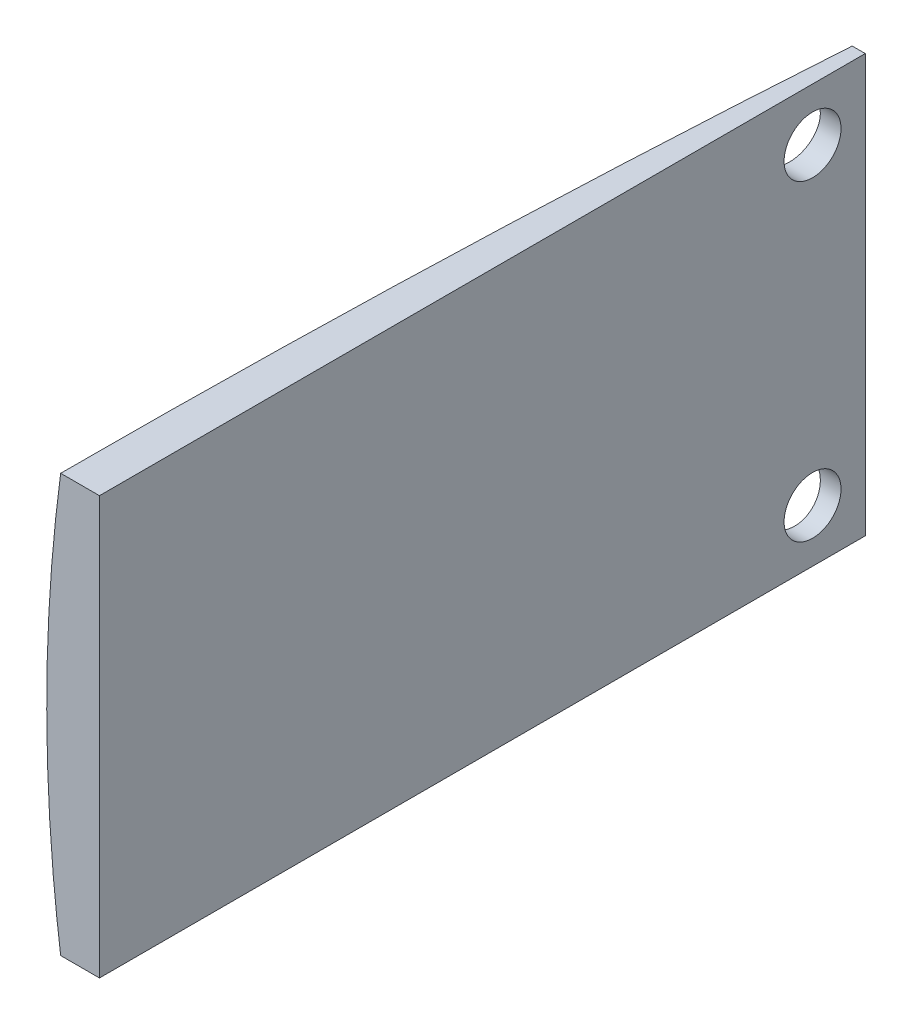
from build123d import *

# Parameters (mm, degrees)
CUT_EXTRUDE2_DEPTH      = 3112.786644088
CUT_EXTRUDE2_DEPTH_BACK = 3112.786644088
SKETCH2_OUTSIDE_W       = 3550.624
SKETCH2_OUTSIDE_H       = 1823.424
SKETCH2_OUTSIDE_W_2     = 184.404
SKETCH2_OUTSIDE_H_2     = 50.292
CUT_EXTRUDE3_START      = 6.35
SKETCH3_W               = 184.404
SKETCH3_H               = 50.292
CUT_EXTRUDE3_DEPTH      = 2742.052714982
SKETCH4_R               = 3.429
CUT_EXTRUDE4_DEPTH      = 96.78023097
SKETCH5_W               = 69.135430889
SKETCH5_H               = 107.37234518
CUT_EXTRUDE5_DEPTH      = 96.78023097


with BuildPart() as part:
    # Sketch1 → Revolve1 (revolve)
    with BuildSketch(Plane.XY):
        with BuildLine():
            Line((1372.87, -509.27), (1372.87, 509.27))
            add(Edge.make_bspline(
                [(1372.87, 509.27), (0, 509.27), (0, 0), (0, -509.27), (1372.87, -509.27)],
                knots=[4.71238898, 4.71238898, 4.71238898, 6.283185307, 6.283185307, 7.853981634, 7.853981634, 7.853981634], degree=2, weights=[1, 0.707106781, 1, 0.707106781, 1]))
        make_face()
    revolve(axis=Axis((1372.87, -509.27, 0), (0, 1, 0)))

    # Sketch2 outside → Cut-Extrude2 (cut, two sides: drawn at the far end of the back side and taken through both)
    with BuildSketch(Plane(origin=(0, 0, 0), x_dir=(0, 0, -1), z_dir=(1, 0, 0)).offset(-CUT_EXTRUDE2_DEPTH_BACK)):
        Rectangle(SKETCH2_OUTSIDE_W, SKETCH2_OUTSIDE_H)
        Rectangle(SKETCH2_OUTSIDE_W_2, SKETCH2_OUTSIDE_H_2, mode=Mode.SUBTRACT)
    extrude(amount=CUT_EXTRUDE2_DEPTH + CUT_EXTRUDE2_DEPTH_BACK, mode=Mode.SUBTRACT)

    # Sketch3 → Cut-Extrude3 (cut, through all)
    with BuildSketch(Plane(origin=(0, 0, 0), x_dir=(0, 0, -1), z_dir=(1, 0, 0)).offset(CUT_EXTRUDE3_START)):
        Rectangle(SKETCH3_W, SKETCH3_H)
    extrude(amount=CUT_EXTRUDE3_DEPTH, mode=Mode.SUBTRACT)

    # Sketch4 → Cut-Extrude4 (cut, through all)
    with BuildSketch(Plane(origin=(6.35, 0, 0), x_dir=(0, 0, -1), z_dir=(1, 0, 0))):
        with Locations((-85.852, 18.796)):
            Circle(SKETCH4_R)
        with Locations((-85.852, -18.796)):
            Circle(SKETCH4_R)
        with Locations((85.852, -18.796)):
            Circle(SKETCH4_R)
        with Locations((85.852, 18.796)):
            Circle(SKETCH4_R)
    extrude(amount=-CUT_EXTRUDE4_DEPTH, mode=Mode.SUBTRACT)

    # Sketch5 → Cut-Extrude5 (cut, through all)
    with BuildSketch(Plane.XY):
        with Locations((-10.995451772, -25.072858782)):
            Rectangle(SKETCH5_W, SKETCH5_H)
    extrude(amount=CUT_EXTRUDE5_DEPTH, mode=Mode.SUBTRACT)


solid = part.part
